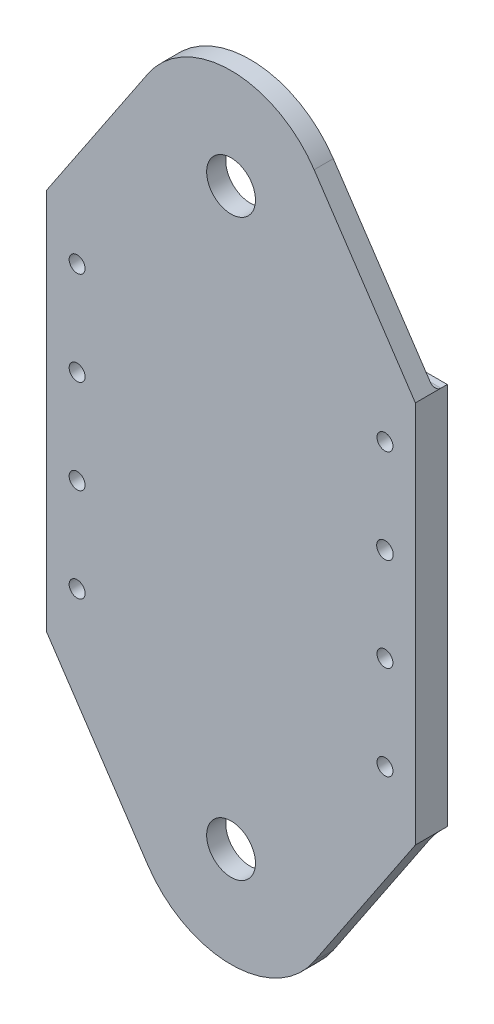
from build123d import *

# Parameters (mm, degrees)
SKETCH1_W      = 146.737083443
SKETCH1_H      = 152.4
SKETCH1_R      = 2.814870932
EXTRUDE1_DEPTH = 12.7
SKETCH2_R      = 3.175
SKETCH2_R_2    = 3.301739158
EXTRUDE2_DEPTH = 192.148134104
SKETCH3_R      = 9.711530505
EXTRUDE3_DEPTH = 7.62
FILLET1_R      = 2.54


with BuildPart() as part:
    # Sketch1 → Extrude1 (new body)
    with BuildSketch(Plane.XY):
        with Locations((39.132231405, -76.2)):
            Rectangle(SKETCH1_W, SKETCH1_H)
        with Locations((-22.131450225, -19.446874936)):
            Circle(SKETCH1_R, mode=Mode.SUBTRACT)
    extrude(amount=EXTRUDE1_DEPTH)

    # Sketch2 → Extrude2 (cut, through all)
    with BuildSketch(Plane(origin=(-5.4e-08, -8.6e-08, -12.901274016), x_dir=(-1.0, 0, 4.210511821155492e-09), z_dir=(-4.210511821155492e-09, -6.669209052807934e-09, -1.0))):
        with Locations(Location((-100.395913074, -19.446875, 0), (0, 0, 90))):
            Circle(SKETCH2_R)
        with Locations(Location((-100.395913114, -56.753124936, 0), (0, 0, 90))):
            Circle(SKETCH2_R_2)
        with Locations(Location((-100.395913114, -94.091124936, 0), (0, 0, 90))):
            Circle(SKETCH2_R)
        with Locations(Location((-100.395913114, -131.429124936, 0), (0, 0, 90))):
            Circle(SKETCH2_R)
        with Locations(Location((22.131450318, -56.753125108, 0), (0, 0, 90))):
            Circle(SKETCH2_R)
        with Locations(Location((22.131450318, -94.091124936, 0), (0, 0, 90))):
            Circle(SKETCH2_R)
        with Locations(Location((22.131450318, -131.429124936, 0), (0, 0, 90))):
            Circle(SKETCH2_R)
        with Locations(Location((22.131450278, -19.446875021, 0), (0, 0, 90))):
            Circle(SKETCH2_R)
    extrude(amount=-EXTRUDE2_DEPTH, mode=Mode.SUBTRACT)

    # Sketch3 → Extrude3 (add)
    # profile 1 of 2: a face of its own
    with BuildSketch(Plane.XY.offset(12.7)):
        with BuildLine():
            Line((112.500773126, -152.4), (-34.236310317, -152.4))
            Line((-34.236310317, -152.4), (6.055614242, -212.627943895))
            ThreePointArc((6.055614242, -212.627943895), (39.132231405, -230.295835259), (72.208848567, -212.627943895))
            Line((72.208848567, -212.627943895), (112.500773126, -152.4))
        make_face()
        with Locations((39.132231405, -190.5)):
            Circle(SKETCH3_R, mode=Mode.SUBTRACT)
    # profile 2 of 2: a face of its own
    with BuildSketch(Plane.XY.offset(12.7)):
        with BuildLine():
            Line((112.500773126, 0), (-34.236310317, 0))
            Line((-34.236310317, 0), (6.055614242, 60.227943895))
            ThreePointArc((6.055614242, 60.227943895), (39.132231405, 77.895835259), (72.208848567, 60.227943895))
            Line((72.208848567, 60.227943895), (112.500773126, 0))
        make_face()
        with Locations((39.132231405, 38.1)):
            Circle(SKETCH3_R, mode=Mode.SUBTRACT)
    extrude(amount=-EXTRUDE3_DEPTH)

    # Fillet1
    fillet1_edges = [part.edges().sort_by_distance(p)[0] for p in [
        (39.132231405, -152.4, 5.08),
        (39.132231405, 0, 5.08),
    ]]
    fillet(fillet1_edges, radius=FILLET1_R)


solid = part.part
